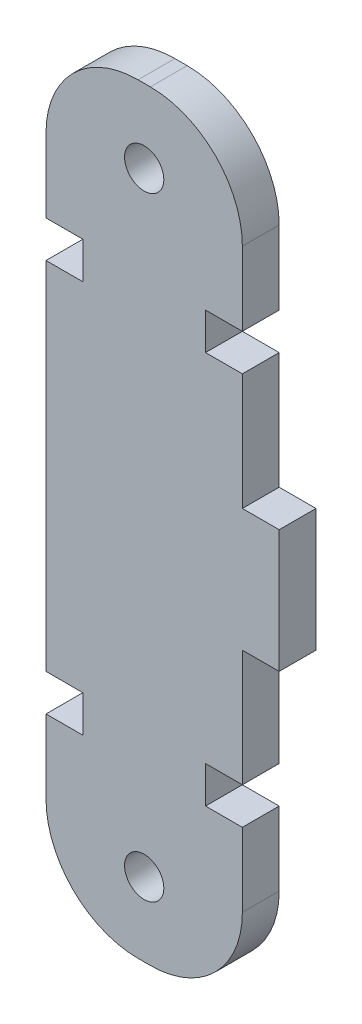
from build123d import *

# Parameters (mm, degrees)
ESBO_O1_R                = 1.6
RESSALTO_EXTRUS_O1_DEPTH = 3
FILETE1_R                = 7.5


with BuildPart() as part:
    # Esboço1 → Ressalto-extrusão1 (new body)
    with BuildSketch(Plane.XY):
        Polygon((-8, 14.5), (-8, -14.5), (-5, -14.5), (-5, -17.5), (-8, -17.5), (-8, -31), (8, -31), (8, -17.5), (5, -17.5), (5, -14.5), (8, -14.5), (8, -5), (11, -5), (11, 5), (8, 5), (8, 14.5), (5, 14.5), (5, 17.5), (8, 17.5), (8, 31), (-8, 31), (-8, 17.5), (-5, 17.5), (-5, 14.5), align=None)
        with Locations((0, -25)):
            Circle(ESBO_O1_R, mode=Mode.SUBTRACT)
        with Locations((0, 25)):
            Circle(ESBO_O1_R, mode=Mode.SUBTRACT)
    extrude(amount=RESSALTO_EXTRUS_O1_DEPTH)

    # Filete1
    filete1_edges = [part.edges().sort_by_distance(p)[0] for p in [
        (-8, 31, 1.5),
        (8, 31, 1.5),
        (8, -31, 1.5),
        (-8, -31, 1.5),
    ]]
    fillet(filete1_edges, radius=FILETE1_R)


solid = part.part
